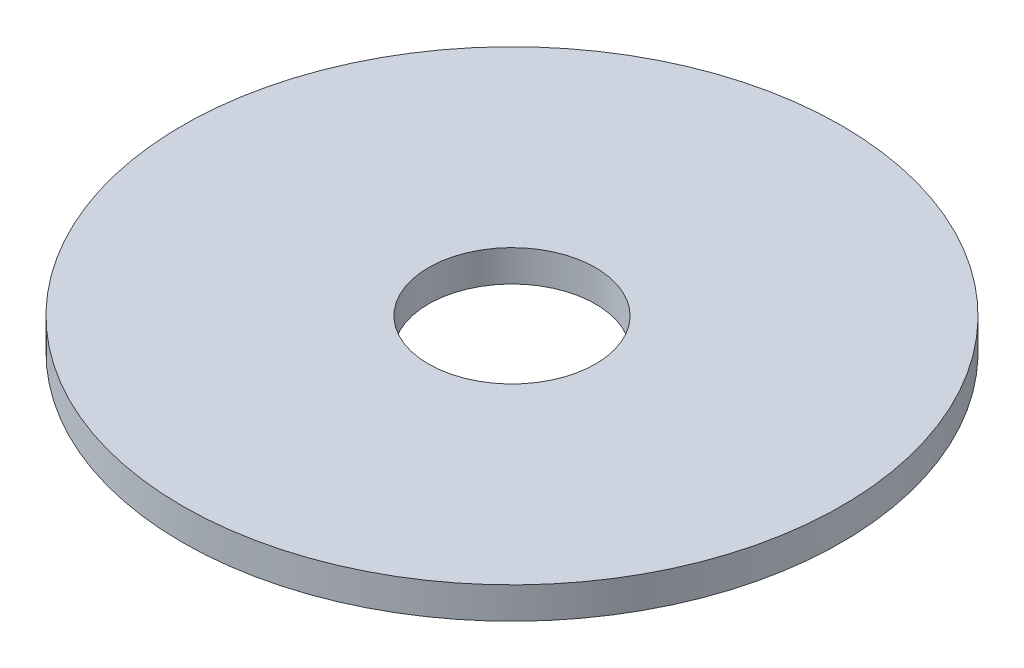
from build123d import *

# Parameters (mm, degrees)
SKETCH1_R           = 104.55
SKETCH1_R_2         = 26.5
BOSS_EXTRUDE1_DEPTH = 10


with BuildPart() as part:
    # Sketch1 → Boss-Extrude1 (new body)
    with BuildSketch(Plane(origin=(0, 0, 0), x_dir=(1, 0, 0), z_dir=(0, 1, 0))):
        with Locations(Location((0, 0, 0), (0, 0, 270))):
            Circle(SKETCH1_R)
        with Locations(Location((0, 0, 0), (0, 0, 270))):
            Circle(SKETCH1_R_2, mode=Mode.SUBTRACT)
    extrude(amount=BOSS_EXTRUDE1_DEPTH)


solid = part.part
